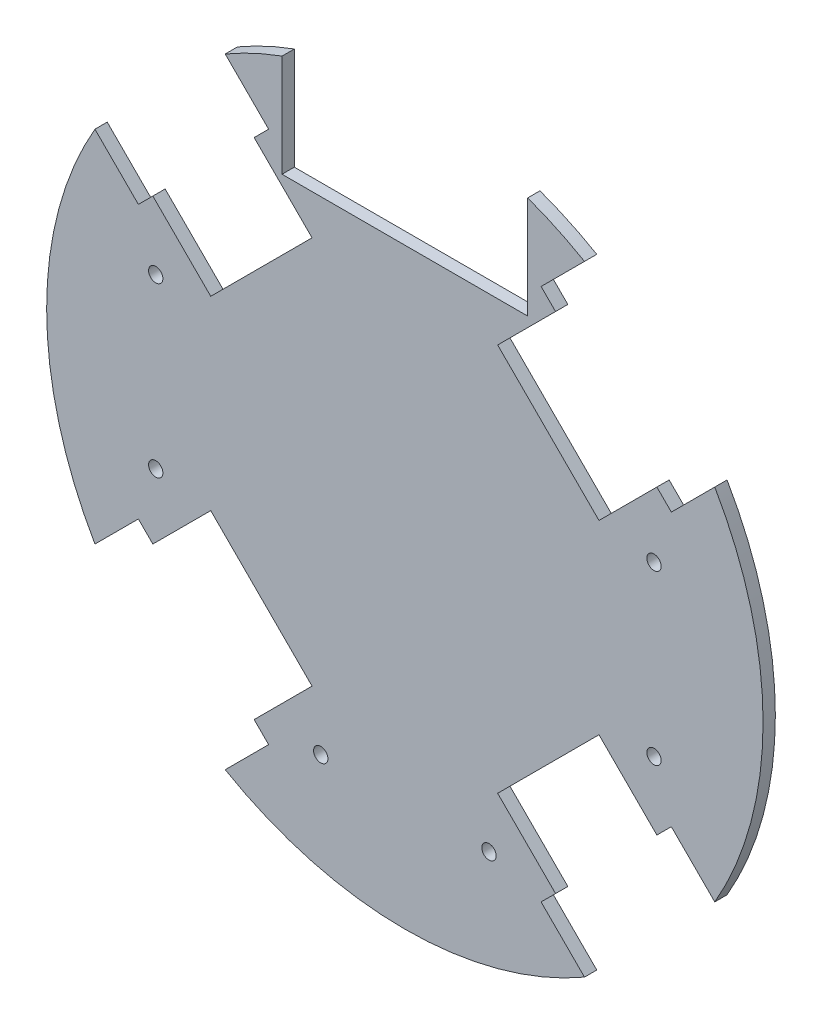
from build123d import *

# Parameters (mm, degrees)
BOSS_EXTRUDE1_DEPTH                        = 3
SKETCH3_R                                  = 1.75
CUT_EXTRUDE1_DEPTH                         = 124.780046857
MIRROR1_AT_THE_SECOND_PLANE_COPY_1_SKETC_R = 1.75
MIRROR1_AT_THE_SECOND_PLANE_COPY_1_DEPTH   = 124.780046857


with BuildPart() as part:
    # Sketch1 → Boss-Extrude1 (new body)
    with BuildSketch(Plane.XY):
        with BuildLine():
            Line((-30, 57.196411114), (30, 57.196411114))
            Line((30, 57.196411114), (30, 82.196411114))
            ThreePointArc((30, 82.196411114), (0, -87.5), (-30, 82.196411114))
            Line((-30, 82.196411114), (-30, 57.196411114))
        make_face()
    extrude(amount=-BOSS_EXTRUDE1_DEPTH)

    # Sketch3 → Cut-Extrude1 (cut, through all)
    with BuildSketch(Plane.XY):
        with BuildLine():
            Line((-61.559070668, 36.810333327), (-47.416935045, 22.668197703))
            Line((-47.416935045, 22.668197703), (-22.668197703, 47.416935045))
            Line((-22.668197703, 47.416935045), (-36.810333327, 61.559070668))
            Line((-36.810333327, 61.559070668), (-33.274799421, 65.094604574))
            Line((-33.274799421, 65.094604574), (-43.881401139, 75.701206292))
            ThreePointArc((-43.881401139, 75.701206292), (-61.871843354, 61.871843354), (-75.701206292, 43.881401139))
            Line((-75.701206292, 43.881401139), (-65.094604574, 33.274799421))
            Line((-65.094604574, 33.274799421), (-61.559070668, 36.810333327))
        make_face()
        with Locations((-60.851963887, 20.54687736)):
            Circle(SKETCH3_R)
        with Locations((-20.54687736, 60.851963887)):
            Circle(SKETCH3_R)
    cut_extrude1 = extrude(amount=-CUT_EXTRUDE1_DEPTH, mode=Mode.SUBTRACT)

    # Mirror1: Cut-Extrude1 across plane
    add(cut_extrude1.mirror(Plane(origin=(0, 0, 0), x_dir=(0, 0, 1), z_dir=(1, 0, 0))), mode=Mode.SUBTRACT)

    # Mirror1 at the second plane: Cut-Extrude1 across plane
    add(cut_extrude1.mirror(Plane.ZX), mode=Mode.SUBTRACT)

    # Mirror1 at the second plane copy 1 sketc → Mirror1 at the second plane copy 1 (cut, through all)
    with BuildSketch(Plane(origin=(0, 0, 0), x_dir=(-1, 0, 0), z_dir=(0, 0, 1))):
        with BuildLine():
            Line((-61.559070668, 36.810333327), (-47.416935045, 22.668197703))
            Line((-47.416935045, 22.668197703), (-22.668197703, 47.416935045))
            Line((-22.668197703, 47.416935045), (-36.810333327, 61.559070668))
            Line((-36.810333327, 61.559070668), (-33.274799421, 65.094604574))
            Line((-33.274799421, 65.094604574), (-43.881401139, 75.701206292))
            ThreePointArc((-43.881401139, 75.701206292), (-61.871843354, 61.871843354), (-75.701206292, 43.881401139))
            Line((-75.701206292, 43.881401139), (-65.094604574, 33.274799421))
            Line((-65.094604574, 33.274799421), (-61.559070668, 36.810333327))
        make_face()
        with Locations((-60.851963887, 20.54687736)):
            Circle(MIRROR1_AT_THE_SECOND_PLANE_COPY_1_SKETC_R)
        with Locations((-20.54687736, 60.851963887)):
            Circle(MIRROR1_AT_THE_SECOND_PLANE_COPY_1_SKETC_R)
    extrude(amount=-MIRROR1_AT_THE_SECOND_PLANE_COPY_1_DEPTH, mode=Mode.SUBTRACT)


solid = part.part
